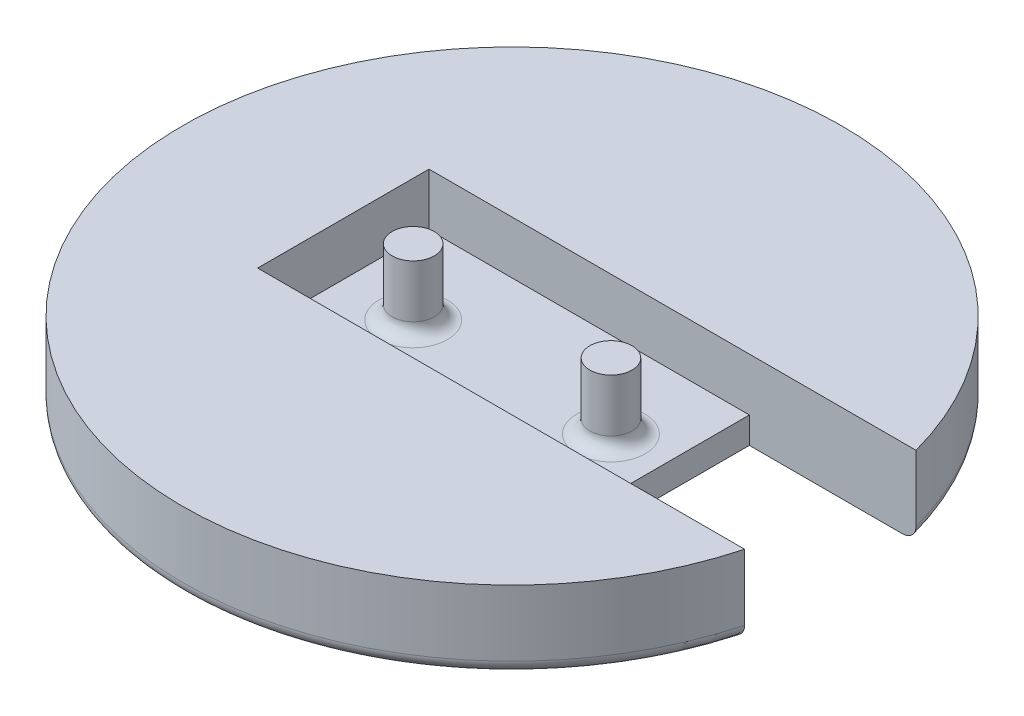
from build123d import *

# Parameters (mm, degrees)
SKETCH1_R           = 1.6
BOSS_EXTRUDE1_DEPTH = 2
BOSS_EXTRUDE2_DEPTH = 4
CUT_EXTRUDE1_REACH  = 37.581
SKETCH3_W           = 13.5
SKETCH3_H           = 13
SKETCH4_R           = 1.6
BOSS_EXTRUDE3_DEPTH = 5
FILLET1_R           = 1
FILLET2_R           = 1


with BuildPart() as part:
    # Sketch1 → Boss-Extrude1 (new body)
    # profile 1 of 4: a face of its own
    with BuildSketch(Plane(origin=(0, 0, 0), x_dir=(1, 0, 0), z_dir=(0, 1, 0))):
        with BuildLine():
            Line((-12.8, -6.5), (-12.8, 6.5))
            Line((-12.8, 6.5), (24.140215409, 6.5))
            ThreePointArc((24.140215409, 6.5), (-25, 0), (24.140215409, -6.5))
            Line((24.140215409, -6.5), (-12.8, -6.5))
        make_face()
    # profile 2 of 4: a face of its own
    with BuildSketch(Plane(origin=(0, 0, 0), x_dir=(1, 0, 0), z_dir=(0, 1, 0))):
        with BuildLine():
            Line((24.140215409, 6.5), (-12.8, 6.5))
            Line((-12.8, 6.5), (-12.8, -6.5))
            Line((-12.8, -6.5), (24.140215409, -6.5))
            ThreePointArc((24.140215409, -6.5), (24.784121784, -3.278308617), (25, 0))
            ThreePointArc((25, 0), (24.784121784, 3.278308617), (24.140215409, 6.5))
        make_face()
        with Locations((-7.5, 0)):
            Circle(SKETCH1_R, mode=Mode.SUBTRACT)
        with Locations((7.5, 0)):
            Circle(SKETCH1_R, mode=Mode.SUBTRACT)
    # profile 3 of 4: a face of its own
    with BuildSketch(Plane(origin=(0, 0, 0), x_dir=(1, 0, 0), z_dir=(0, 1, 0))):
        with Locations((-7.5, 0)):
            Circle(SKETCH1_R)
    # profile 4 of 4: a face of its own
    with BuildSketch(Plane(origin=(0, 0, 0), x_dir=(1, 0, 0), z_dir=(0, 1, 0))):
        with Locations((7.5, 0)):
            Circle(SKETCH1_R)
    extrude(amount=BOSS_EXTRUDE1_DEPTH)

    # Sketch2 → Boss-Extrude2 (add)
    with BuildSketch(Plane(origin=(0, 2, 0), x_dir=(1, 0, 0), z_dir=(0, 1, 0))):
        with BuildLine():
            Line((24.140215409, -6.5), (-12.8, -6.5))
            Line((-12.8, -6.5), (-12.8, 6.5))
            Line((-12.8, 6.5), (24.140215409, 6.5))
            ThreePointArc((24.140215409, 6.5), (-25, 0), (24.140215409, -6.5))
        make_face()
    extrude(amount=BOSS_EXTRUDE2_DEPTH)

    # Sketch3 → Cut-Extrude1 (cut, up to next)
    with BuildSketch(Plane(origin=(0, 2, 0), x_dir=(1, 0, 0), z_dir=(0, 1, 0)), mode=Mode.PRIVATE) as cut_extrude1_sk1:
        with Locations((18.25, 0)):
            Rectangle(SKETCH3_W, SKETCH3_H)
    cut_extrude1_tool1 = extrude(cut_extrude1_sk1.sketch, amount=-CUT_EXTRUDE1_REACH, mode=Mode.PRIVATE) & part.part
    add(cut_extrude1_tool1.solids().sort_by_distance((18.25, 2, 0))[0], mode=Mode.SUBTRACT)

    # Sketch4 → Boss-Extrude3 (add)
    with BuildSketch(Plane(origin=(0, 2, 0), x_dir=(1, 0, 0), z_dir=(0, 1, 0))):
        with Locations(Location((7.5, 0, 0), (0, 0, 270))):
            Circle(SKETCH4_R)
        with Locations(Location((-7.5, 0, 0), (0, 0, 270))):
            Circle(SKETCH4_R)
    extrude(amount=BOSS_EXTRUDE3_DEPTH)

    # Fillet1
    fillet1_edges = [part.edges().sort_by_distance(p)[0] for p in [
        (7.5, 2, -1.6),
        (-7.5, 2, -1.6),
    ]]
    fillet(fillet1_edges, radius=FILLET1_R)

    # Fillet2
    fillet2_edges = [part.edges().sort_by_distance(p)[0] for p in [
        (-25, 0, 0),
    ]]
    fillet(fillet2_edges, radius=FILLET2_R)


solid = part.part
